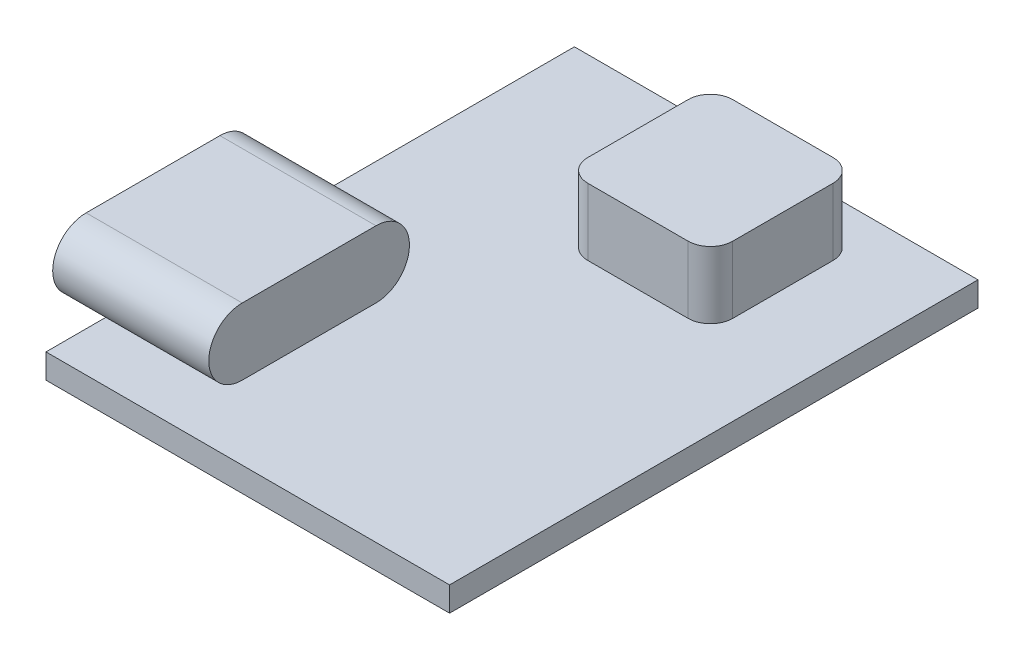
from build123d import *

# Parameters (mm, degrees)
SKETCH1_W                = 18.1
SKETCH1_H                = 23.7
BOSS_EXTRUDE1_DEPTH      = 1.1
BOSS_EXTRUDE2_DEPTH      = 1.5
BOSS_EXTRUDE2_DEPTH_BACK = 5.5
SHELL1_T                 = -0.3
SKETCH4_W                = 6.5
SKETCH4_H                = 6.5
BOSS_EXTRUDE3_DEPTH      = 3
FILLET1_R                = 1


with BuildPart() as part:
    # Sketch1 → Boss-Extrude1 (new body)
    with BuildSketch(Plane(origin=(0, 0, 0), x_dir=(1, 0, 0), z_dir=(0, 1, 0))):
        Rectangle(SKETCH1_W, SKETCH1_H)
    extrude(amount=BOSS_EXTRUDE1_DEPTH)


with BuildPart() as body_2:
    # Sketch3 → Boss-Extrude2 (new, two sides: drawn at the far end of the back side and taken through both)
    with BuildSketch(Plane.ZY.offset(9.05).offset(-BOSS_EXTRUDE2_DEPTH_BACK)):
        with BuildLine():
            Line((2.55, 4.1), (8.55, 4.1))
            ThreePointArc((8.55, 4.1), (10.05, 2.6), (8.55, 1.1))
            Line((8.55, 1.1), (2.55, 1.1))
            ThreePointArc((2.55, 1.1), (1.05, 2.6), (2.55, 4.1))
        make_face()
    extrude(amount=BOSS_EXTRUDE2_DEPTH + BOSS_EXTRUDE2_DEPTH_BACK)

    # Shell1
    shell1_openings = [body_2.faces().sort_by_distance(p)[0] for p in [
        (-10.55, 2.6, 5.55),
    ]]
    offset(amount=SHELL1_T, openings=shell1_openings, kind=Kind.INTERSECTION)


with BuildPart() as body_3:
    # Sketch4 → Boss-Extrude3 (new body)
    with BuildSketch(Plane(origin=(0, 1.1, 0), x_dir=(1, 0, 0), z_dir=(0, 1, 0))):
        with Locations((1.8, 7.1)):
            Rectangle(SKETCH4_W, SKETCH4_H)
    extrude(amount=BOSS_EXTRUDE3_DEPTH)

    # Fillet1
    fillet1_edges = [body_3.edges().sort_by_distance(p)[0] for p in [
        (-1.45, 2.6, -10.35),
        (5.05, 2.6, -10.35),
        (5.05, 2.6, -3.85),
        (-1.45, 2.6, -3.85),
    ]]
    fillet(fillet1_edges, radius=FILLET1_R)


solid = Compound([part.part, body_2.part, body_3.part])
